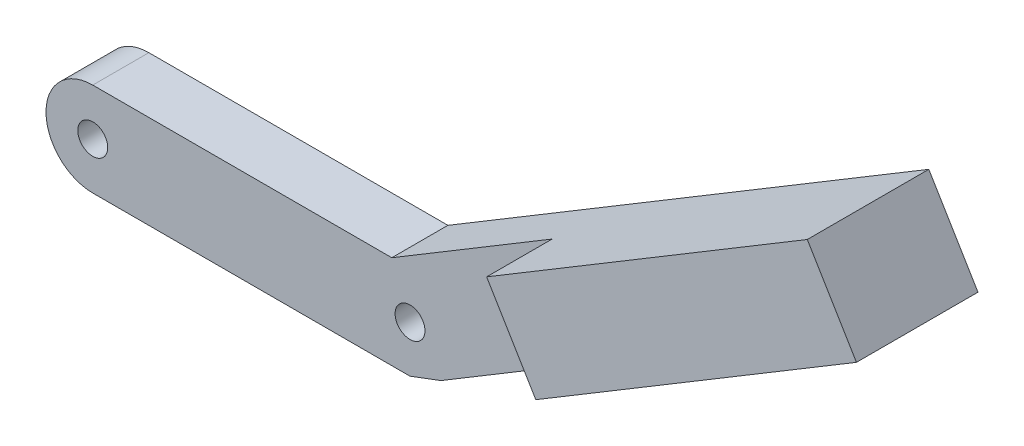
from build123d import *

# Parameters (mm, degrees)
SKETCH1_R               = 1.6
BOSS_EXTRUDE1_DEPTH     = 6
SALIENTE_EXTRUIR1_DEPTH = 7


with BuildPart() as part:
    # Sketch1 → Boss-Extrude1 (new body)
    # profile 1 of 2: a face of its own
    with BuildSketch(Plane.XY):
        with BuildLine():
            Line((31.98, 5), (0, 5))
            ThreePointArc((0, 5), (-5, 0), (0, -5))
            Line((0, -5), (33.93, -5))
            Line((33.93, -5), (37.237412205, -3.749803263))
            ThreePointArc((37.237412205, -3.749803263), (38.607019153, 1.767906062), (33.93, 5))
            Line((33.93, 5), (31.98, 5))
        make_face()
        Circle(SKETCH1_R, mode=Mode.SUBTRACT)
        with Locations((33.93, 0)):
            Circle(SKETCH1_R, mode=Mode.SUBTRACT)
    # profile 2 of 2: a face of its own
    with BuildSketch(Plane.XY):
        with BuildLine():
            Line((83.410038042, 35.902284495), (31.98, 5))
            Line((31.98, 5), (33.93, 5))
            ThreePointArc((33.93, 5), (38.607019153, 1.767906062), (37.237412205, -3.749803263))
            Line((37.237412205, -3.749803263), (88.667450247, 27.152481232))
            Line((88.667450247, 27.152481232), (83.410038042, 35.902284495))
        make_face()
    extrude(amount=BOSS_EXTRUDE1_DEPTH)

    # Croquis3 → Saliente-Extruir1 (add)
    with BuildSketch(Plane.XY.offset(6)):
        Polygon((83.410038042, 35.902284495), (88.667450247, 27.152481232), (54.380758219, 6.550958236), (49.123346014, 15.300761498), align=None)
    extrude(amount=SALIENTE_EXTRUIR1_DEPTH)


solid = part.part
